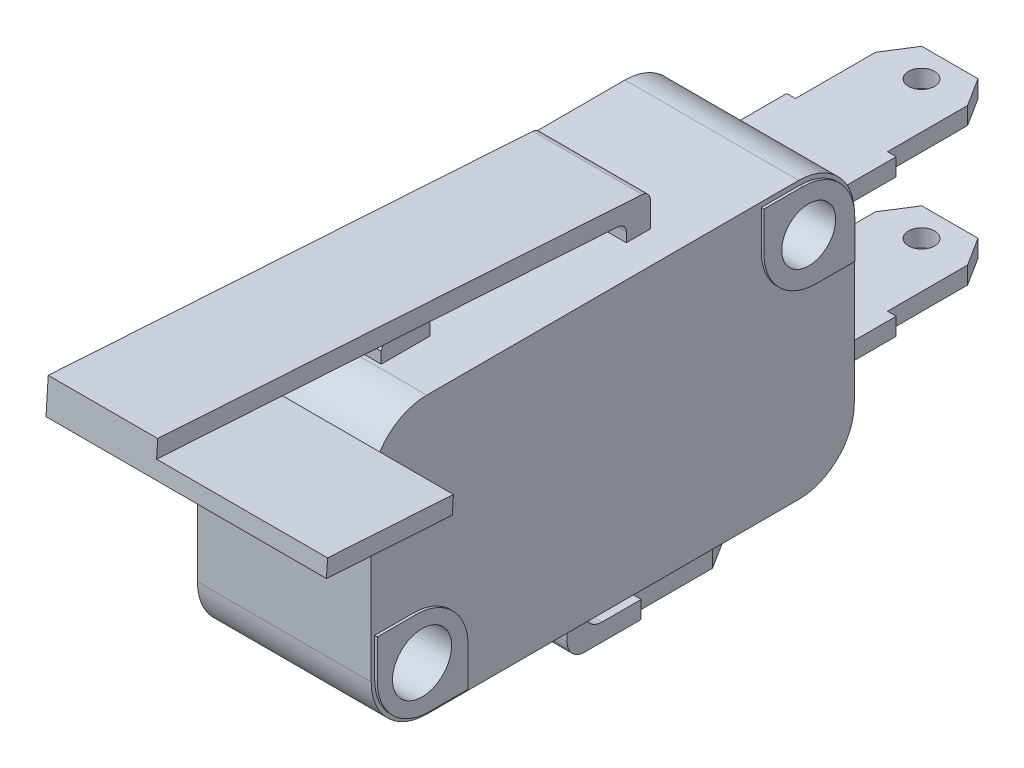
from build123d import *
from build123d.topology import SkipClean

# Parameters (mm, degrees)
BLOCOBASE_DEPTH           = 5
SKFIXACAO_R               = 1.7
SKFIXACAO_R_2             = 1.55
FIXACAO_DEPTH             = 5.15
RESSALTOFIXACAO_START     = 0.15
RESSALTOFIXACAO_DEPTH     = 0.15
BOTAO_DEPTH               = 2.15
SKETCH5_W                 = 6.3
SKETCH5_H                 = 1
BASECONECTORNONC_DEPTH    = 10.5
DESENHOCONECTORNONC_DEPTH = 20.5
BASECONECTORCOM_DEPTH     = 3.15
DESENHOCONECTORCOM_DEPTH  = 1
BASECONTATO_DEPTH         = 3.15
SKAPOIOROLO_R             = 0.7
APOIOROLO_DEPTH           = 1
SKROLO_R                  = 2.5
ROLO_DEPTH                = 4.3
SKETCH6_W                 = 15.037683952
SKETCH6_H                 = 10.848275608
CUT_EXTRUDE1_DEPTH        = 10
SKETCH7_W                 = 16.137668404
SKETCH7_H                 = 7.258990492
BOSS_EXTRUDE1_DEPTH       = 1


with BuildPart() as part:
    # skBlocoBase → BlocoBase (new, symmetric)
    with BuildSketch(Plane(origin=(0, 0, 0), x_dir=(0, 0, -1), z_dir=(1, 0, 0))):
        with BuildLine():
            Line((-10.7, 7.95), (10.7, 7.95))
            ThreePointArc((10.7, 7.95), (12.9627417, 7.0127417), (13.9, 4.75))
            Line((13.9, 4.75), (13.9, -4.75))
            ThreePointArc((13.9, -4.75), (12.9627417, -7.0127417), (10.7, -7.95))
            Line((10.7, -7.95), (-10.7, -7.95))
            ThreePointArc((-10.7, -7.95), (-12.9627417, -7.0127417), (-13.9, -4.75))
            Line((-13.9, -4.75), (-13.9, 4.75))
            ThreePointArc((-13.9, 4.75), (-12.9627417, 7.0127417), (-10.7, 7.95))
        make_face()
    extrude(amount=BLOCOBASE_DEPTH, both=True)

    # skFixacao → Fixacao (cut, symmetric)
    with BuildSketch(Plane(origin=(0, 0, 0), x_dir=(0, 0, -1), z_dir=(1, 0, 0))):
        with Locations((-11.125, -5.1)):
            Circle(SKFIXACAO_R)
        with Locations((11.125, 5.1)):
            Circle(SKFIXACAO_R_2)
    extrude(amount=FIXACAO_DEPTH, both=True, mode=Mode.SUBTRACT)

    # skRessaltoFixacao → RessaltoFixacao (add)
    # profile 1 of 2: a face of its own
    with SkipClean():  # the faces are left unmerged after this step: merging them gives an invalid solid
        with BuildSketch(Plane(origin=(5, 0, 0), x_dir=(0, 0, -1), z_dir=(1, 0, 0)).offset(RESSALTOFIXACAO_START)):
            with BuildLine():
                ThreePointArc((-8.475, -5.525), (-9.353679656, -3.403679656), (-11.475, -2.525))
                Line((-11.475, -2.525), (-13.7, -2.525))
                Line((-13.7, -2.525), (-13.7, -4.75))
                ThreePointArc((-13.7, -4.75), (-12.821320344, -6.871320344), (-10.7, -7.75))
                Line((-10.7, -7.75), (-8.475, -7.75))
                Line((-8.475, -7.75), (-8.475, -5.525))
            make_face()
            with BuildLine():
                ThreePointArc((-9.789845005, -6.152312282), (-10.474438165, -6.670595205), (-11.325, -6.788194302))
                ThreePointArc((-11.325, -6.788194302), (-11.775561835, -3.529404795), (-9.789845005, -6.152312282))
            make_face(mode=Mode.SUBTRACT)
        # profile 2 of 2: a face of its own
        with BuildSketch(Plane(origin=(5, 0, 0), x_dir=(0, 0, -1), z_dir=(1, 0, 0)).offset(RESSALTOFIXACAO_START)):
            with BuildLine():
                ThreePointArc((13.775, 4.675), (12.896320344, 6.796320344), (10.775, 7.675))
                Line((10.775, 7.675), (8.55, 7.675))
                Line((8.55, 7.675), (8.55, 5.45))
                ThreePointArc((8.55, 5.45), (9.428679656, 3.328679656), (11.55, 2.45))
                Line((11.55, 2.45), (13.775, 2.45))
                Line((13.775, 2.45), (13.775, 4.675))
            make_face()
            with BuildLine():
                ThreePointArc((12.353274612, 4.1545681), (11.71815932, 3.667986725), (10.925, 3.562957385))
                ThreePointArc((10.925, 3.562957385), (10.53184068, 6.532013275), (12.353274612, 4.1545681))
            make_face(mode=Mode.SUBTRACT)
        ressaltofixacao = extrude(amount=-RESSALTOFIXACAO_DEPTH)

    # MirrorRessaltoFixacao: RessaltoFixacao across plane
    with SkipClean():  # the faces are left unmerged after this step: merging them gives an invalid solid
        add(ressaltofixacao.mirror(Plane(origin=(0, 0, 0), x_dir=(0, 0, 1), z_dir=(1, 0, 0))))

    # skBotao → Botao (add, symmetric)
    with SkipClean():  # the faces are left unmerged after this step: merging them gives an invalid solid
        with BuildSketch(Plane(origin=(0, 0, 0), x_dir=(0, 0, -1), z_dir=(1, 0, 0))):
            with BuildLine():
                Line((-10.475, 7.95), (-10.475, 8.6))
                ThreePointArc((-10.475, 8.6), (-9.075, 9.6), (-7.675, 8.6))
                Line((-7.675, 8.6), (-7.675, 7.95))
                Line((-7.675, 7.95), (-10.475, 7.95))
            make_face()
        extrude(amount=BOTAO_DEPTH, both=True)

    # Sketch5 → BaseConectorNONC (add)
    with SkipClean():  # the faces are left unmerged after this step: merging them gives an invalid solid
        with BuildSketch(Plane(origin=(0, 0, -13.9), x_dir=(-1, 0, 0), z_dir=(0, 0, -1))):
            with Locations((0, -3.975)):
                Rectangle(SKETCH5_W, SKETCH5_H)
            with Locations((0, 3.975)):
                Rectangle(SKETCH5_W, SKETCH5_H)
        extrude(amount=BASECONECTORNONC_DEPTH)

    # skDesenhoConectorNONC → DesenhoConectorNONC (cut)
    with SkipClean():  # the faces are left unmerged after this step: merging them gives an invalid solid
        with BuildSketch(Plane.XZ.offset(4.475)):
            Polygon((2.65, -22.767142952), (1.616967042, -24.4), (3.15, -24.4), (3.15, -18.161236833), (2.65, -18.161236833), align=None)
            Polygon((-3.15, -24.4), (-1.616967042, -24.4), (-2.65, -22.767142952), (-2.65, -18.161236833), (-3.15, -18.161236833), align=None)
            with BuildLine():
                ThreePointArc((0, -22.017142952), (-0.75, -22.767142952), (0, -23.517142952))
                Line((0, -23.517142952), (0, -22.017142952))
            make_face()
            with BuildLine():
                Line((0, -22.017142952), (0, -23.517142952))
                ThreePointArc((0, -23.517142952), (0.530330086, -23.297473038), (0.75, -22.767142952))
                ThreePointArc((0.75, -22.767142952), (0.530330086, -22.236812866), (0, -22.017142952))
            make_face()
        extrude(amount=-DESENHOCONECTORNONC_DEPTH, mode=Mode.SUBTRACT)

    # skBaseConectorCOM → BaseConectorCOM (add, symmetric)
    with SkipClean():  # the faces are left unmerged after this step: merging them gives an invalid solid
        with BuildSketch(Plane(origin=(0, 0, 0), x_dir=(0, 0, -1), z_dir=(1, 0, 0))):
            with BuildLine():
                Line((9.725, -11.25), (0.225, -11.25))
                ThreePointArc((0.225, -11.25), (-0.482106781, -10.957106781), (-0.775, -10.25))
                Line((-0.775, -10.25), (-0.775, -7.95))
                Line((-0.775, -7.95), (0.225, -7.95))
                Line((0.225, -7.95), (0.225, -9.25))
                ThreePointArc((0.225, -9.25), (0.517893219, -9.957106781), (1.225, -10.25))
                Line((1.225, -10.25), (9.725, -10.25))
                Line((9.725, -10.25), (9.725, -11.25))
            make_face()
        extrude(amount=BASECONECTORCOM_DEPTH, both=True)

    # skDesenhoConectorCOM → DesenhoConectorCOM (cut)
    with SkipClean():  # the faces are left unmerged after this step: merging them gives an invalid solid
        with BuildSketch(Plane.XZ.offset(11.25)):
            Polygon((2.65, -8.092142952), (1.616967042, -9.725), (3.15, -9.725), (3.15, -3.486236833), (2.65, -3.486236833), align=None)
            with BuildLine():
                ThreePointArc((0, -7.342142952), (-0.75, -8.092142952), (0, -8.842142952))
                Line((0, -8.842142952), (0, -7.342142952))
            make_face()
            with BuildLine():
                Line((0, -7.342142952), (0, -8.842142952))
                ThreePointArc((0, -8.842142952), (0.530330086, -8.622473038), (0.75, -8.092142952))
                ThreePointArc((0.75, -8.092142952), (0.530330086, -7.561812866), (0, -7.342142952))
            make_face()
            Polygon((-3.15, -9.725), (-1.616967042, -9.725), (-2.65, -8.092142952), (-2.65, -3.486236833), (-3.15, -3.486236833), align=None)
        extrude(amount=-DESENHOCONECTORCOM_DEPTH, mode=Mode.SUBTRACT)

    # skBaseContato → BaseContato (add, symmetric)
    with SkipClean():  # the faces are left unmerged after this step: merging them gives an invalid solid
        with BuildSketch(Plane(origin=(0, 0, 0), x_dir=(0, 0, -1), z_dir=(1, 0, 0))):
            with BuildLine():
                Line((2.63302332, 7.95), (2.63302332, 8.486635004))
                ThreePointArc((2.63302332, 8.486635004), (2.497665983, 8.828739854), (2.164880406, 8.985619098))
                Line((2.164880406, 8.985619098), (-24.4, 10.681624431))
                Line((-24.4, 10.681624431), (-24.336285828, 11.679592619))
                Line((-24.336285828, 11.679592619), (3.545575005, 9.899506131))
                ThreePointArc((3.545575005, 9.899506131), (3.878360582, 9.742626887), (4.013717919, 9.400522037))
                Line((4.013717919, 9.400522037), (4.013717919, 7.95))
                Line((4.013717919, 7.95), (2.63302332, 7.95))
            make_face()
        extrude(amount=BASECONTATO_DEPTH, both=True)

    # skApoioRolo → ApoioRolo (add)
    with SkipClean():  # the faces are left unmerged after this step: merging them gives an invalid solid
        with BuildSketch(Plane(origin=(3.15, 0, 0), x_dir=(0, 0, -1), z_dir=(1, 0, 0))):
            with BuildLine():
                ThreePointArc((-21.354211514, 14.486814776), (-22.754211514, 15.886814776), (-24.154211514, 14.486814776))
                Line((-24.154211514, 14.486814776), (-24.336285828, 11.679592619))
                Line((-24.336285828, 11.679592619), (-22.939130364, 11.590392778))
                Line((-22.939130364, 11.590392778), (-21.541974901, 11.501192936))
                Line((-21.541974901, 11.501192936), (-21.365242034, 14.3114187))
                Line((-21.365242034, 14.3114187), (-21.354211514, 14.486814776))
            make_face()
            with Locations((-22.754211514, 14.486814776)):
                Circle(SKAPOIOROLO_R, mode=Mode.SUBTRACT)
        apoiorolo = extrude(amount=-APOIOROLO_DEPTH)

    # MirrorApoioRolo: ApoioRolo across plane
    with SkipClean():  # the faces are left unmerged after this step: merging them gives an invalid solid
        add(apoiorolo.mirror(Plane(origin=(0, 0, 0), x_dir=(0, 0, 1), z_dir=(1, 0, 0))))

    # skRolo → Rolo (add)
    with SkipClean():  # the faces are left unmerged after this step: merging them gives an invalid solid
        with BuildSketch(Plane.ZY.offset(-2.15)):
            with Locations(Location((22.754211514, 14.486814776, 0), (0, 0, 239.619073526))):
                Circle(SKROLO_R)
        extrude(amount=ROLO_DEPTH)

    # Sketch6 → Cut-Extrude1 (cut)
    with SkipClean():  # the faces are left unmerged after this step: merging them gives an invalid solid
        with BuildSketch(Plane(origin=(0, 10.084763511, -0.643850544), x_dir=(1, 0, 0), z_dir=(0, 0.9979681879895416, -0.06371417237060659))):
            with Locations((-4.368841976, -23.671158356)):
                Rectangle(SKETCH6_W, SKETCH6_H)
        extrude(amount=CUT_EXTRUDE1_DEPTH, mode=Mode.SUBTRACT)

    # Sketch7 → Boss-Extrude1 (add)
    with SkipClean():  # the faces are left unmerged after this step: merging them gives an invalid solid
        with BuildSketch(Plane(origin=(0, 9.086795323, -0.580136372), x_dir=(1, 0, 0), z_dir=(0, -0.9979681879895416, 0.06371417237060648))):
            with Locations((4.918834202, 21.401499401)):
                Rectangle(SKETCH7_W, SKETCH7_H)
        extrude(amount=BOSS_EXTRUDE1_DEPTH)


solid = part.part
